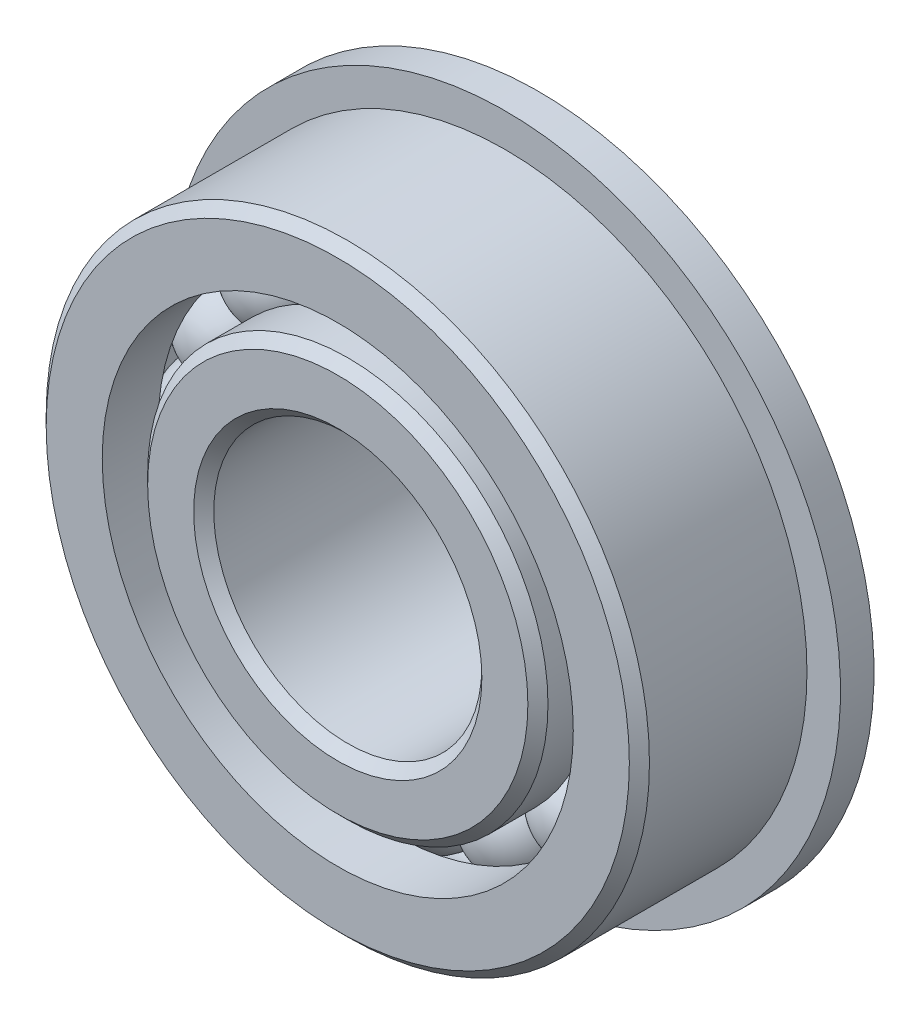
from build123d import *

# Parameters (mm, degrees)
CIRPATTERN1_COUNT = 16
SKETCH6_W         = 1.5875
SKETCH6_H         = 4.718887363


with BuildPart() as part:
    # Sketch1 → Revolve1 (revolve)
    with BuildSketch(Plane(origin=(0, 0, 0), x_dir=(0, 0, -1), z_dir=(1, 0, 0)), mode=Mode.PRIVATE) as revolve1_sk:
        with BuildLine():
            Line((4.28625, 14.2875), (-4.28625, 14.2875))
            Line((-4.28625, 14.2875), (-4.7625, 13.81125))
            Line((-4.7625, 13.81125), (-4.7625, 11.156112637))
            Line((-4.7625, 11.156112637), (-2.116666667, 11.156112637))
            ThreePointArc((-2.116666667, 11.156112637), (0, 12.595030731), (2.116666667, 11.156112637))
            Line((2.116666667, 11.156112637), (4.7625, 11.156112637))
            Line((4.7625, 11.156112637), (4.7625, 13.81125))
            Line((4.7625, 13.81125), (4.28625, 14.2875))
        make_face()
    revolve(revolve1_sk.sketch.rotate(Axis((0, 0, 4.7625), (0, 0, -1)), 90), axis=Axis((0, 0, 4.7625), (0, 0, -1)))

    # Sketch6 → Revolve6 (revolve)
    with BuildSketch(Plane(origin=(0, 0, 0), x_dir=(0, 0, -1), z_dir=(1, 0, 0)), mode=Mode.PRIVATE) as revolve6_sk:
        with Locations((3.96875, 13.515556319)):
            Rectangle(SKETCH6_W, SKETCH6_H)
    revolve(revolve6_sk.sketch.rotate(Axis((0, 0, -4.7625), (0, 0, 1)), 270), axis=Axis((0, 0, -4.7625), (0, 0, 1)))


with BuildPart() as body_2:
    # Sketch3 → Revolve3 (revolve)
    with BuildSketch(Plane(origin=(0, 0, 0), x_dir=(0, 0, -1), z_dir=(1, 0, 0)), mode=Mode.PRIVATE) as revolve3_sk:
        with BuildLine():
            Line((-4.7625, 6.82625), (-4.7625, 9.005137363))
            Line((-4.7625, 9.005137363), (-4.28625, 9.481387363))
            Line((-4.28625, 9.481387363), (-2.116666667, 9.481387363))
            ThreePointArc((-2.116666667, 9.481387363), (0, 8.042469269), (2.116666667, 9.481387363))
            Line((2.116666667, 9.481387363), (5.87375, 9.481387363))
            Line((5.87375, 9.481387363), (6.35, 9.005137363))
            Line((6.35, 9.005137363), (6.35, 6.82625))
            Line((6.35, 6.82625), (5.87375, 6.35))
            Line((5.87375, 6.35), (-4.28625, 6.35))
            Line((-4.28625, 6.35), (-4.7625, 6.82625))
        make_face()
    revolve(revolve3_sk.sketch.rotate(Axis((0, 0, 4.7625), (0, 0, -1)), 90), axis=Axis((0, 0, 4.7625), (0, 0, -1)))


with BuildPart() as body_3:
    # Sketch4 → Revolve4 (revolve)
    with BuildSketch(Plane(origin=(0, 0, 0), x_dir=(0, 0, -1), z_dir=(1, 0, 0))):
        with BuildLine():
            Line((-2.276280731, 10.31875), (2.276280731, 10.31875))
            ThreePointArc((2.276280731, 10.31875), (0, 12.595030731), (-2.276280731, 10.31875))
        make_face()
    revolve(axis=Axis((0, 10.31875, 2.276280731), (0, 0, -1)))


with BuildPart() as cirpattern1_1:
    # CirPattern1: pattern copy
    add(body_3.part.rotate(Axis((0, 0, 0), (0, 0, 1)), 1 * 360 / CIRPATTERN1_COUNT))


with BuildPart() as cirpattern1_2:
    # CirPattern1: pattern copy
    add(body_3.part.rotate(Axis((0, 0, 0), (0, 0, 1)), 2 * 360 / CIRPATTERN1_COUNT))


with BuildPart() as cirpattern1_3:
    # CirPattern1: pattern copy
    add(body_3.part.rotate(Axis((0, 0, 0), (0, 0, 1)), 3 * 360 / CIRPATTERN1_COUNT))


with BuildPart() as cirpattern1_4:
    # CirPattern1: pattern copy
    add(body_3.part.rotate(Axis((0, 0, 0), (0, 0, 1)), 4 * 360 / CIRPATTERN1_COUNT))


with BuildPart() as cirpattern1_5:
    # CirPattern1: pattern copy
    add(body_3.part.rotate(Axis((0, 0, 0), (0, 0, 1)), 5 * 360 / CIRPATTERN1_COUNT))


with BuildPart() as cirpattern1_6:
    # CirPattern1: pattern copy
    add(body_3.part.rotate(Axis((0, 0, 0), (0, 0, 1)), 6 * 360 / CIRPATTERN1_COUNT))


with BuildPart() as cirpattern1_7:
    # CirPattern1: pattern copy
    add(body_3.part.rotate(Axis((0, 0, 0), (0, 0, 1)), 7 * 360 / CIRPATTERN1_COUNT))


with BuildPart() as cirpattern1_8:
    # CirPattern1: pattern copy
    add(body_3.part.rotate(Axis((0, 0, 0), (0, 0, 1)), 8 * 360 / CIRPATTERN1_COUNT))


with BuildPart() as cirpattern1_9:
    # CirPattern1: pattern copy
    add(body_3.part.rotate(Axis((0, 0, 0), (0, 0, 1)), 9 * 360 / CIRPATTERN1_COUNT))


with BuildPart() as cirpattern1_10:
    # CirPattern1: pattern copy
    add(body_3.part.rotate(Axis((0, 0, 0), (0, 0, 1)), 10 * 360 / CIRPATTERN1_COUNT))


with BuildPart() as cirpattern1_11:
    # CirPattern1: pattern copy
    add(body_3.part.rotate(Axis((0, 0, 0), (0, 0, 1)), 11 * 360 / CIRPATTERN1_COUNT))


with BuildPart() as cirpattern1_12:
    # CirPattern1: pattern copy
    add(body_3.part.rotate(Axis((0, 0, 0), (0, 0, 1)), 12 * 360 / CIRPATTERN1_COUNT))


with BuildPart() as cirpattern1_13:
    # CirPattern1: pattern copy
    add(body_3.part.rotate(Axis((0, 0, 0), (0, 0, 1)), 13 * 360 / CIRPATTERN1_COUNT))


with BuildPart() as cirpattern1_14:
    # CirPattern1: pattern copy
    add(body_3.part.rotate(Axis((0, 0, 0), (0, 0, 1)), 14 * 360 / CIRPATTERN1_COUNT))


with BuildPart() as cirpattern1_15:
    # CirPattern1: pattern copy
    add(body_3.part.rotate(Axis((0, 0, 0), (0, 0, 1)), 15 * 360 / CIRPATTERN1_COUNT))


solid = Compound([part.part, body_2.part, body_3.part, cirpattern1_1.part, cirpattern1_2.part, cirpattern1_3.part, cirpattern1_4.part, cirpattern1_5.part, cirpattern1_6.part, cirpattern1_7.part, cirpattern1_8.part, cirpattern1_9.part, cirpattern1_10.part, cirpattern1_11.part, cirpattern1_12.part, cirpattern1_13.part, cirpattern1_14.part, cirpattern1_15.part])
